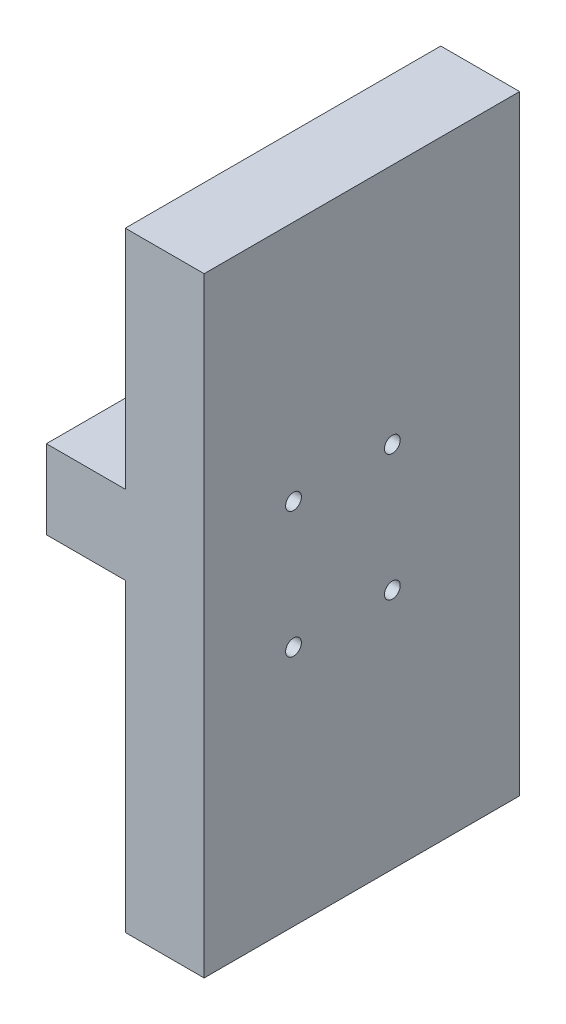
from build123d import *

# Parameters (mm, degrees)
CROQUIS1_W              = 60
CROQUIS1_H              = 116
SALIENTE_EXTRUIR1_DEPTH = 15
CROQUIS2_W              = 15
CROQUIS2_H              = 15
SALIENTE_EXTRUIR2_DEPTH = 15
CROQUIS3_R              = 1.5
CORTAR_EXTRUIR1_DEPTH   = 135


with BuildPart() as part:
    # Croquis1 → Saliente-Extruir1 (new body)
    with BuildSketch(Plane(origin=(0, 0, 0), x_dir=(0, 0, -1), z_dir=(1, 0, 0))):
        with Locations((30, 58)):
            Rectangle(CROQUIS1_W, CROQUIS1_H)
    extrude(amount=SALIENTE_EXTRUIR1_DEPTH)

    # Croquis2 → Saliente-Extruir2 (add)
    with BuildSketch(Plane.ZY):
        with Locations((-52.5, 50.5)):
            Rectangle(CROQUIS2_W, CROQUIS2_H)
        with Locations((-7.5, 65.5)):
            Rectangle(CROQUIS2_W, CROQUIS2_H)
    extrude(amount=SALIENTE_EXTRUIR2_DEPTH)

    # Croquis3 → Cortar-Extruir1 (cut, through all)
    with BuildSketch(Plane(origin=(15, 0, 0), x_dir=(0, 0, -1), z_dir=(1, 0, 0))):
        with Locations((17, 70)):
            Circle(CROQUIS3_R)
        with Locations((17, 46)):
            Circle(CROQUIS3_R)
        with Locations((35.8, 70)):
            Circle(CROQUIS3_R)
        with Locations((35.8, 46)):
            Circle(CROQUIS3_R)
    extrude(amount=-CORTAR_EXTRUIR1_DEPTH, mode=Mode.SUBTRACT)


solid = part.part
